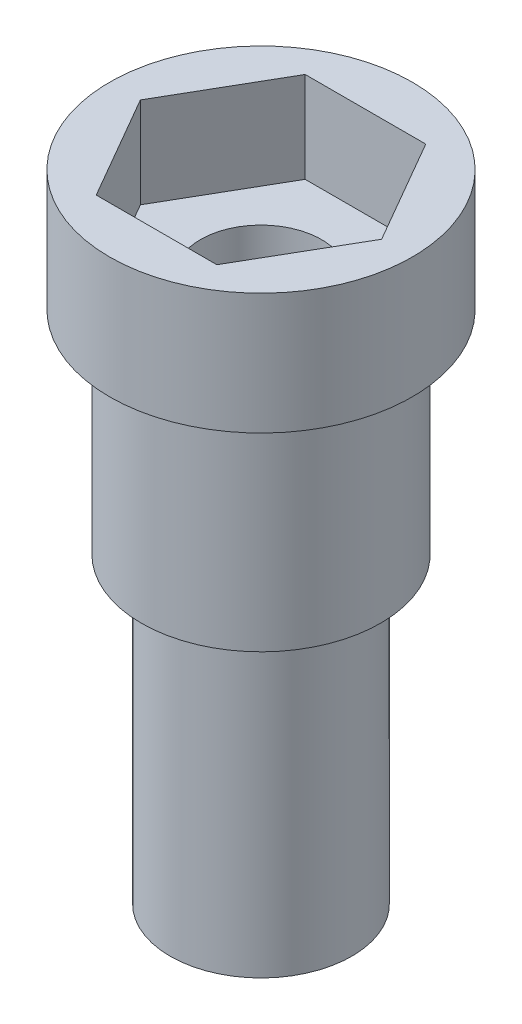
from build123d import *

# Parameters (mm, degrees)
SKETCH1_R           = 3
SKETCH1_R_2         = 2
BOSS_EXTRUDE1_DEPTH = 18
BOSS_EXTRUDE3_START = -8
SKETCH2_R           = 3.95
SKETCH2_R_2         = 2
BOSS_EXTRUDE3_DEPTH = 7
SKETCH4_R           = 5
SKETCH4_R_2         = 2
BOSS_EXTRUDE4_DEPTH = 4
CUT_EXTRUDE1_DEPTH  = 3


with BuildPart() as part:
    # Sketch1 → Boss-Extrude1 (new body)
    with BuildSketch(Plane(origin=(0, 0, 0), x_dir=(1, 0, 0), z_dir=(0, 1, 0))):
        with Locations(Location((0, 0, 0), (0, 0, 270))):
            Circle(SKETCH1_R)
        with Locations(Location((0, 0, 0), (0, 0, 270))):
            Circle(SKETCH1_R_2, mode=Mode.SUBTRACT)
    extrude(amount=BOSS_EXTRUDE1_DEPTH)

    # Sketch2 → Boss-Extrude3 (add)
    with BuildSketch(Plane(origin=(0, 18, 0), x_dir=(1, 0, 0), z_dir=(0, 1, 0)).offset(BOSS_EXTRUDE3_START)):
        with Locations(Location((0, 0, 0), (0, 0, 270))):
            Circle(SKETCH2_R)
        with Locations(Location((0, 0, 0), (0, 0, 270))):
            Circle(SKETCH2_R_2, mode=Mode.SUBTRACT)
    extrude(amount=BOSS_EXTRUDE3_DEPTH)

    # Sketch4 → Boss-Extrude4 (add)
    with BuildSketch(Plane(origin=(0, 17, 0), x_dir=(1, 0, 0), z_dir=(0, 1, 0))):
        with Locations(Location((0, 0, 0), (0, 0, 270))):
            Circle(SKETCH4_R)
        with Locations(Location((0, 0, 0), (0, 0, 270))):
            Circle(SKETCH4_R_2, mode=Mode.SUBTRACT)
    extrude(amount=BOSS_EXTRUDE4_DEPTH)

    # Sketch5 → Cut-Extrude1 (cut)
    with BuildSketch(Plane(origin=(0, 21, 0), x_dir=(1, 0, 0), z_dir=(0, 1, 0))):
        Polygon((3.983716857, 0), (1.991858429, 3.45), (-1.991858429, 3.45), (-3.983716857, 0), (-1.991858429, -3.45), (1.991858429, -3.45), align=None)
    extrude(amount=-CUT_EXTRUDE1_DEPTH, mode=Mode.SUBTRACT)


solid = part.part
